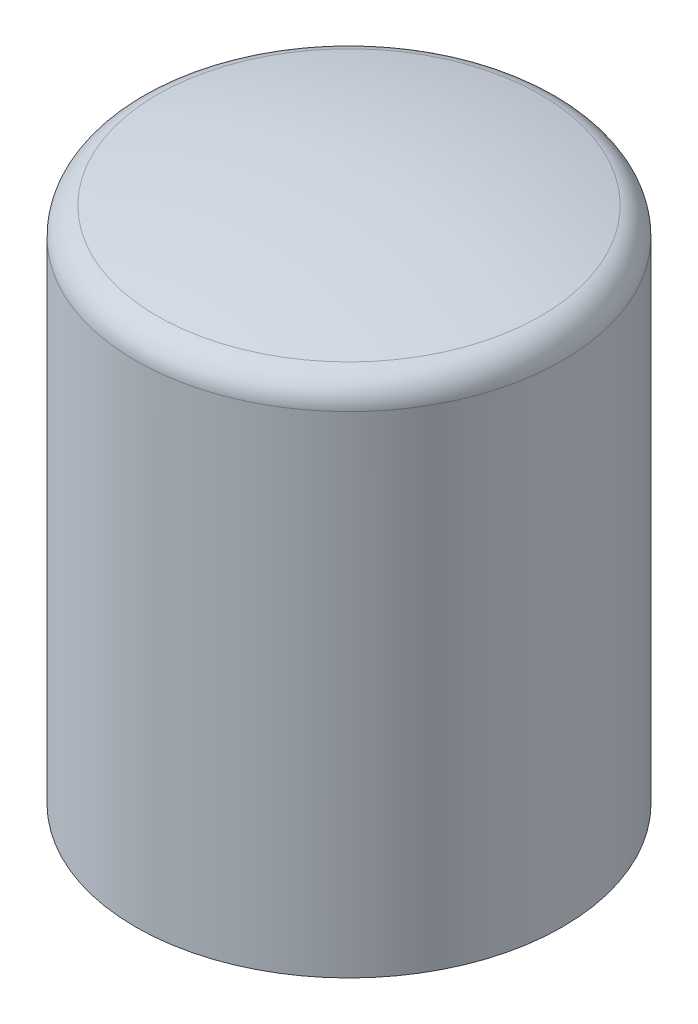
from build123d import *

# Parameters (mm, degrees)
SKETCH1_R           = 7.5
BOSS_EXTRUDE1_DEPTH = 18
DOME1_FACE_RADIUS   = 7.5
DOME1_HEIGHT        = 1
FILLET1_R           = 1
SKETCH2_R           = 3.3
CUT_EXTRUDE1_DEPTH  = 6.35
SKETCH3_W           = 1.48
SKETCH3_H           = 4.164804918
BOSS_EXTRUDE2_DEPTH = 6.35


with BuildPart() as part:
    # Sketch1 → Boss-Extrude1 (new body)
    with BuildSketch(Plane(origin=(0, 0, 0), x_dir=(1, 0, 0), z_dir=(0, 1, 0))):
        with Locations(Location((0, 0, 0), (0, 0, 270))):
            Circle(SKETCH1_R)
    extrude(amount=BOSS_EXTRUDE1_DEPTH)

    # Dome1: a dome of height H over a round flat face of radius A is a cap of a sphere of radius (A * A + H * H) / (2 * H)
    dome1_r = (DOME1_FACE_RADIUS * DOME1_FACE_RADIUS + DOME1_HEIGHT * DOME1_HEIGHT) / (2 * DOME1_HEIGHT)
    dome1_base = Plane((0, 18, 0), z_dir=(0, 1, 0))
    with Locations(dome1_base.offset(DOME1_HEIGHT - dome1_r)):
        dome1_ball = Sphere(dome1_r, mode=Mode.PRIVATE)
    add(split(dome1_ball, bisect_by=dome1_base, keep=Keep.TOP, mode=Mode.PRIVATE))

    # Fillet1
    fillet1_edges = [part.edges().sort_by_distance(p)[0] for p in [
        (0, 18, -7.5),
    ]]
    fillet(fillet1_edges, radius=FILLET1_R)

    # Sketch2 → Cut-Extrude1 (cut)
    with BuildSketch(Plane.XZ):
        with Locations(Location((0, 0, 0), (0, 0, 270))):
            Circle(SKETCH2_R)
    extrude(amount=-CUT_EXTRUDE1_DEPTH, mode=Mode.SUBTRACT)

    # Sketch3 → Boss-Extrude2 (add)
    with BuildSketch(Plane.XZ.offset(-6.35)):
        with Locations((3.3, 0)):
            Rectangle(SKETCH3_W, SKETCH3_H)
    extrude(amount=BOSS_EXTRUDE2_DEPTH)


solid = part.part
